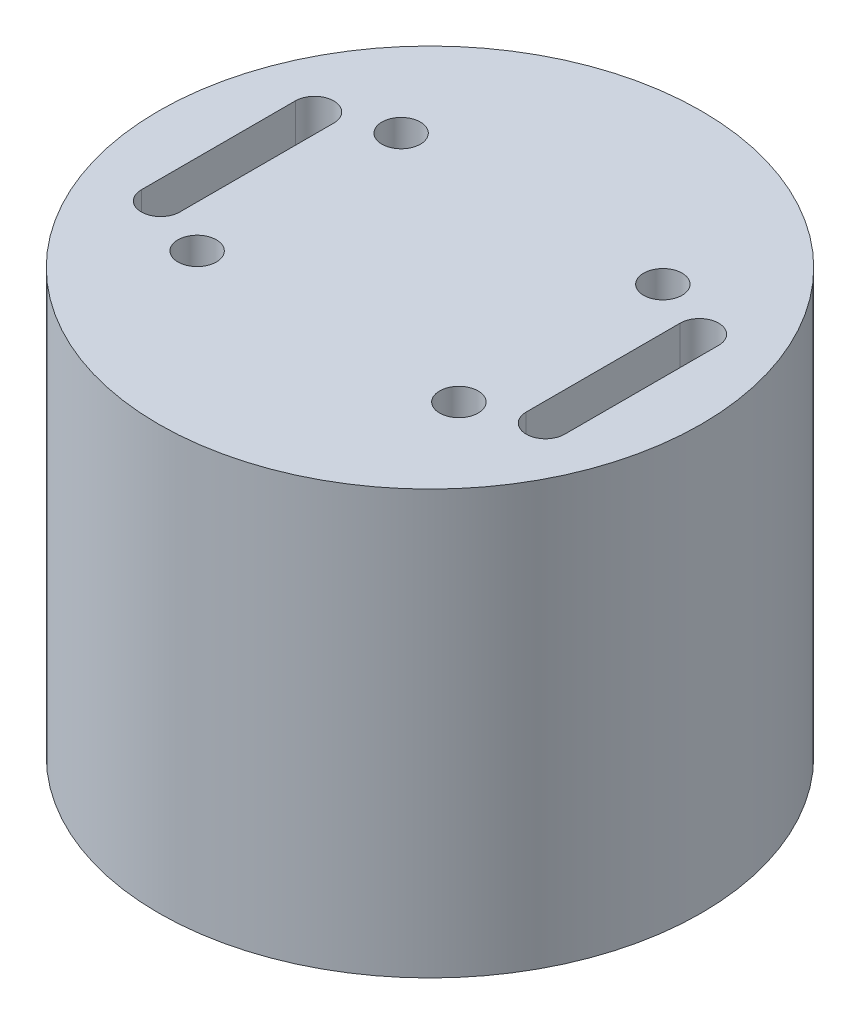
from build123d import *

# Parameters (mm, degrees)
SKETCH1_R           = 70.5
BOSS_EXTRUDE1_DEPTH = 10
SKETCH2_R           = 5
CUT_EXTRUDE1_DEPTH  = 101.202295383
BOSS_EXTRUDE2_START = 100
SKETCH3_R           = 70.5
SKETCH3_R_2         = 60.5
BOSS_EXTRUDE2_DEPTH = 100
CUT_EXTRUDE2_DEPTH  = 149.460432439


with BuildPart() as part:
    # Sketch1 → Boss-Extrude1 (new body)
    with BuildSketch(Plane(origin=(0, 0, 0), x_dir=(1, 0, 0), z_dir=(0, 1, 0))):
        with Locations(Location((0, 0, 0), (0, 0, 270))):
            Circle(SKETCH1_R)
    extrude(amount=BOSS_EXTRUDE1_DEPTH)

    # Sketch2 → Cut-Extrude1 (cut, through all)
    with BuildSketch(Plane(origin=(0, 10, 0), x_dir=(1, 0, 0), z_dir=(0, 1, 0))):
        with Locations(Location((-34, -26.5, 0), (0, 0, 270))):
            Circle(SKETCH2_R)
        with Locations(Location((34, -26.5, 0), (0, 0, 270))):
            Circle(SKETCH2_R)
        with Locations(Location((34, 26.5, 0), (0, 0, 270))):
            Circle(SKETCH2_R)
        with Locations(Location((-34, 26.5, 0), (0, 0, 270))):
            Circle(SKETCH2_R)
    extrude(amount=-CUT_EXTRUDE1_DEPTH, mode=Mode.SUBTRACT)

    # Sketch3 → Boss-Extrude2 (add)
    with BuildSketch(Plane.XZ.offset(BOSS_EXTRUDE2_START)):
        with Locations(Location((0, 0, 0), (0, 0, 270))):
            Circle(SKETCH3_R)
        with Locations(Location((0, 0, 0), (0, 0, 270))):
            Circle(SKETCH3_R_2, mode=Mode.SUBTRACT)
    extrude(amount=-BOSS_EXTRUDE2_DEPTH)

    # Sketch4 → Cut-Extrude2 (cut, through all)
    with BuildSketch(Plane(origin=(0, 10, 0), x_dir=(1, 0, 0), z_dir=(0, 1, 0))):
        with BuildLine():
            Line((55, 20), (55, -20))
            ThreePointArc((55, -20), (50, -25), (45, -20))
            Line((45, -20), (45, 20))
            ThreePointArc((45, 20), (50, 25), (55, 20))
        make_face()
    cut_extrude2 = extrude(amount=-CUT_EXTRUDE2_DEPTH, mode=Mode.SUBTRACT)

    # Mirror1: Cut-Extrude2 across plane
    add(cut_extrude2.mirror(Plane(origin=(0, 0, 0), x_dir=(0, 0, 1), z_dir=(1, 0, 0))), mode=Mode.SUBTRACT)


solid = part.part
